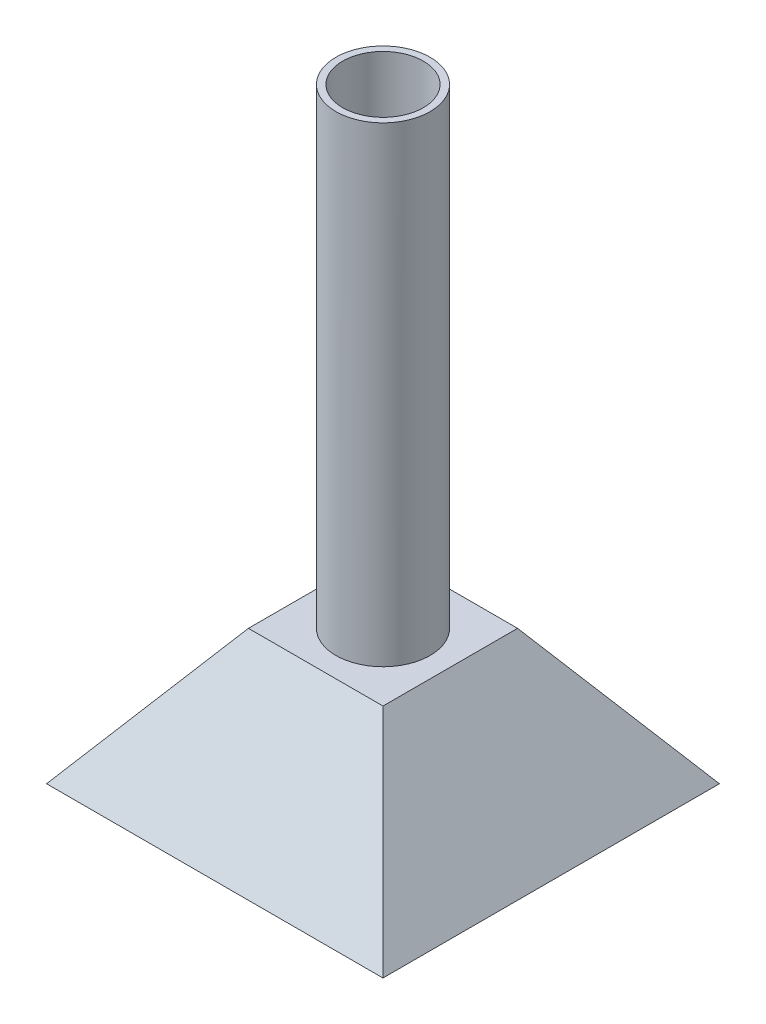
from build123d import *

# Parameters (mm, degrees)
SKETCH3_R           = 17.78
SKETCH3_R_2         = 15.24
BOSS_EXTRUDE1_DEPTH = 177.8


with BuildPart() as part:
    # Sketch2 → Loft1 section 0
    with BuildSketch(Plane(origin=(0, 50.8, 0), x_dir=(1, 0, 0), z_dir=(0, 1, 0))):
        with BuildLine():
            Line((-25.4, -25.4), (25.4, -25.4))
            Line((25.4, -25.4), (25.4, 25.4))
            Line((25.4, 25.4), (-25.4, 25.4))
            Line((-25.4, 25.4), (-25.4, -25.4))
        make_face()
    # Sketch1 → Loft1 section 1
    with BuildSketch(Plane(origin=(0, 0, 0), x_dir=(1, 0, 0), z_dir=(0, 1, 0))):
        with BuildLine():
            Line((-63.5, -63.5), (63.5, -63.5))
            Line((63.5, -63.5), (63.5, 63.5))
            Line((63.5, 63.5), (-63.5, 63.5))
            Line((-63.5, 63.5), (-63.5, -63.5))
        make_face()
    loft()

    # Sketch3 → Boss-Extrude1 (add)
    with BuildSketch(Plane(origin=(0, 50.8, 0), x_dir=(1, 0, 0), z_dir=(0, 1, 0))):
        with Locations(Location((0, 0, 0), (0, 0, 90))):
            Circle(SKETCH3_R)
        with Locations(Location((0, 0, 0), (0, 0, 270))):
            Circle(SKETCH3_R_2, mode=Mode.SUBTRACT)
    extrude(amount=BOSS_EXTRUDE1_DEPTH)


solid = part.part
